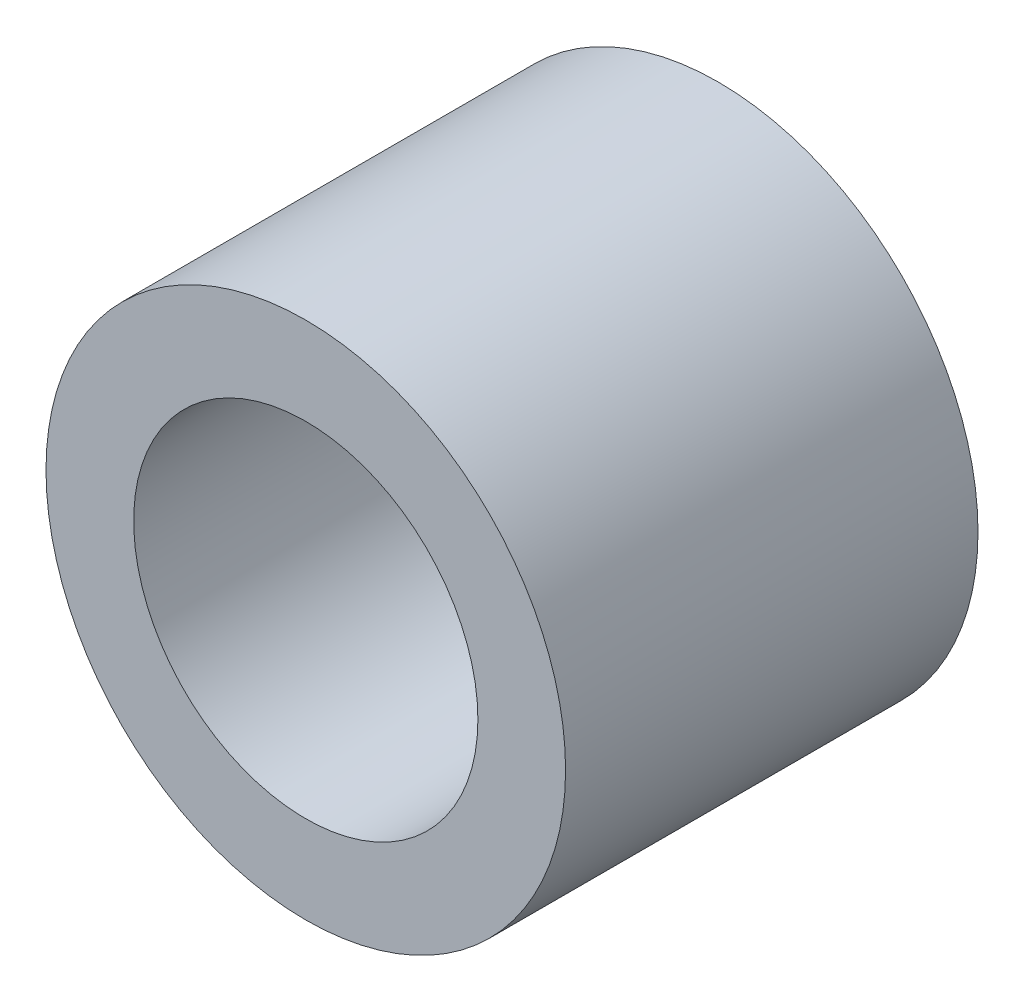
from build123d import *

# Parameters (mm, degrees)
SKETCH1_R           = 4
SKETCH1_R_2         = 2.65
BOSS_EXTRUDE1_DEPTH = 6.35


with BuildPart() as part:
    # Sketch1 → Boss-Extrude1 (new body)
    with BuildSketch(Plane.XY):
        Circle(SKETCH1_R)
        Circle(SKETCH1_R_2, mode=Mode.SUBTRACT)
    extrude(amount=BOSS_EXTRUDE1_DEPTH)


solid = part.part
